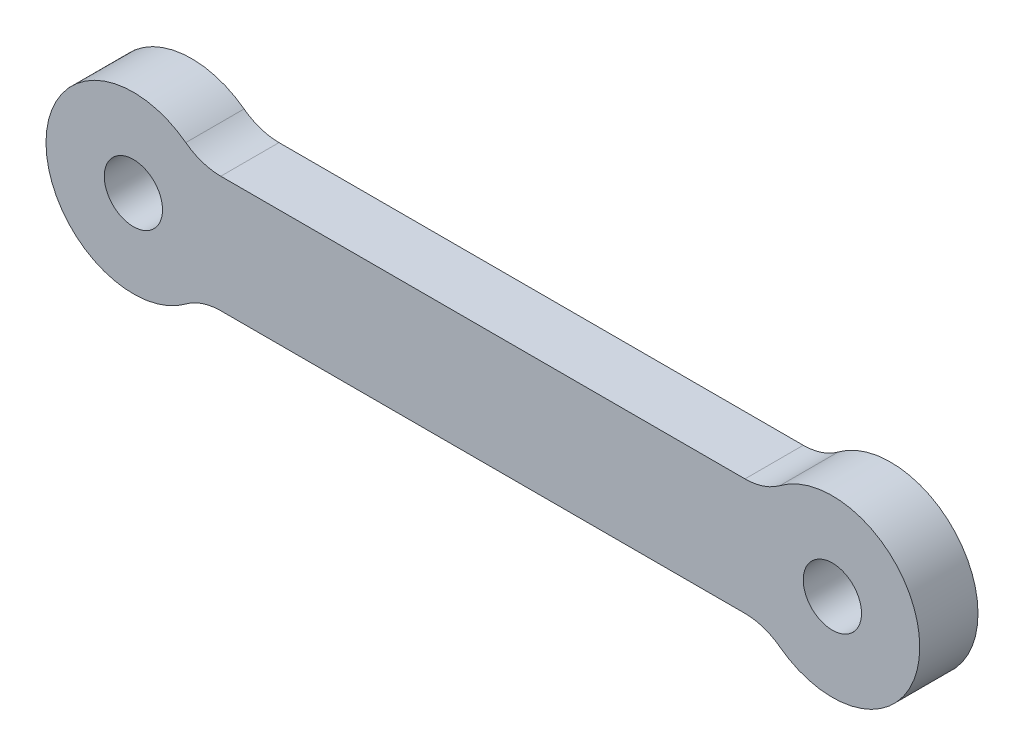
from build123d import *

# Parameters (mm, degrees)
SKETCH1_R           = 3.175
BOSS_EXTRUDE1_DEPTH = 3.175


with BuildPart() as part:
    # Sketch1 → Boss-Extrude1 (new, symmetric)
    with BuildSketch(Plane.XY):
        with BuildLine():
            Line((-66.675, 6.35), (-9.525, 6.35))
            ThreePointArc((-9.525, 6.35), (-7.516953686, 6.675861057), (-5.715, 7.62))
            ThreePointArc((-5.715, 7.62), (9.525, 0), (-5.715, -7.62))
            ThreePointArc((-5.715, -7.62), (-7.516953686, -6.675861057), (-9.525, -6.35))
            Line((-9.525, -6.35), (-66.675, -6.35))
            ThreePointArc((-66.675, -6.35), (-68.683046314, -6.675861057), (-70.485, -7.62))
            ThreePointArc((-70.485, -7.62), (-85.725, 0), (-70.485, 7.62))
            ThreePointArc((-70.485, 7.62), (-68.683046314, 6.675861057), (-66.675, 6.35))
        make_face()
        with Locations((-76.2, 0)):
            Circle(SKETCH1_R, mode=Mode.SUBTRACT)
        Circle(SKETCH1_R, mode=Mode.SUBTRACT)
    extrude(amount=BOSS_EXTRUDE1_DEPTH, both=True)


solid = part.part
